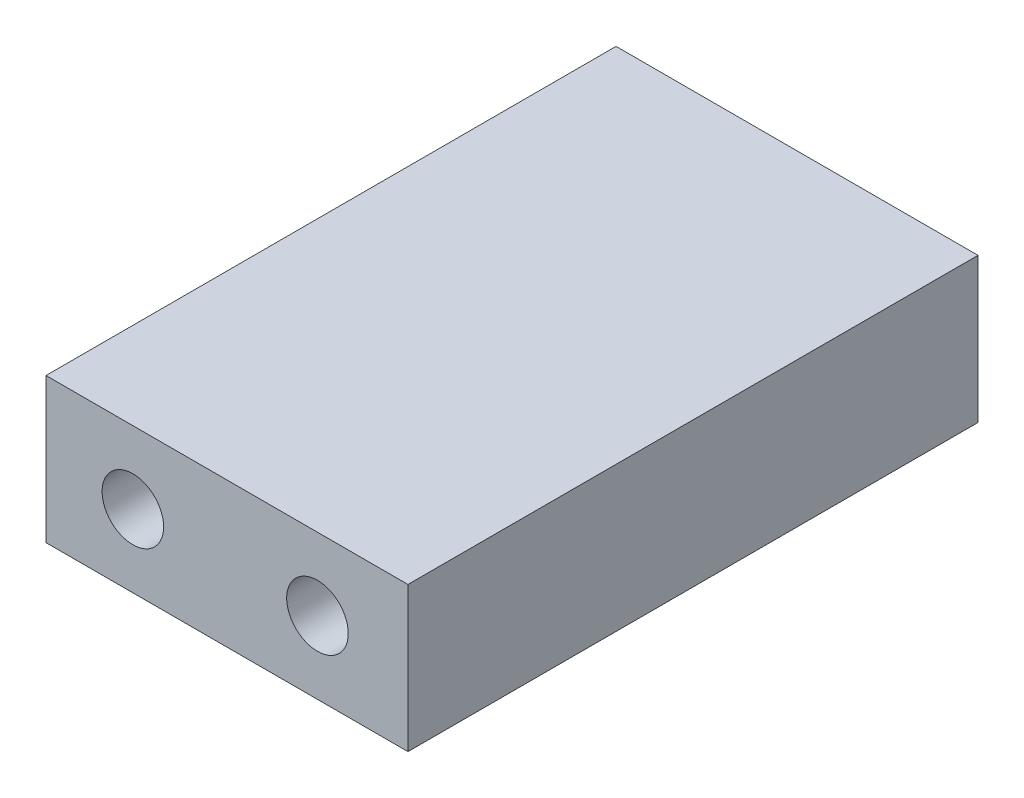
from build123d import *

# Parameters (mm, degrees)
ESQUISSE1_W                = 20
ESQUISSE1_H                = 8
BOSS_EXTRU_1_DEPTH         = 31.5
D_GAGEMENT_M31_D           = 3.4
R_P_TITION_LIN_AIRE1_COUNT = 2
R_P_TITION_LIN_AIRE1_PITCH = 10.2


with BuildPart() as part:
    # Esquisse1 → Boss.-Extru.1 (new body)
    with BuildSketch(Plane.XY):
        with Locations((-7.314758755, -1.171717172)):
            Rectangle(ESQUISSE1_W, ESQUISSE1_H)
    extrude(amount=BOSS_EXTRU_1_DEPTH)

    # Dégagement M31 (through all)
    with Locations(Plane.XY.offset(31.5)):
        with Locations((-2.314758755, -1.171717172)):
            d_gagement_m31 = Hole(D_GAGEMENT_M31_D / 2)

    # Répétition linéaire1: Dégagement M31 ×2
    with Locations(*[(-i * R_P_TITION_LIN_AIRE1_PITCH, 0, 0) for i in range(1, R_P_TITION_LIN_AIRE1_COUNT)]):
        add(d_gagement_m31, mode=Mode.SUBTRACT)


solid = part.part
